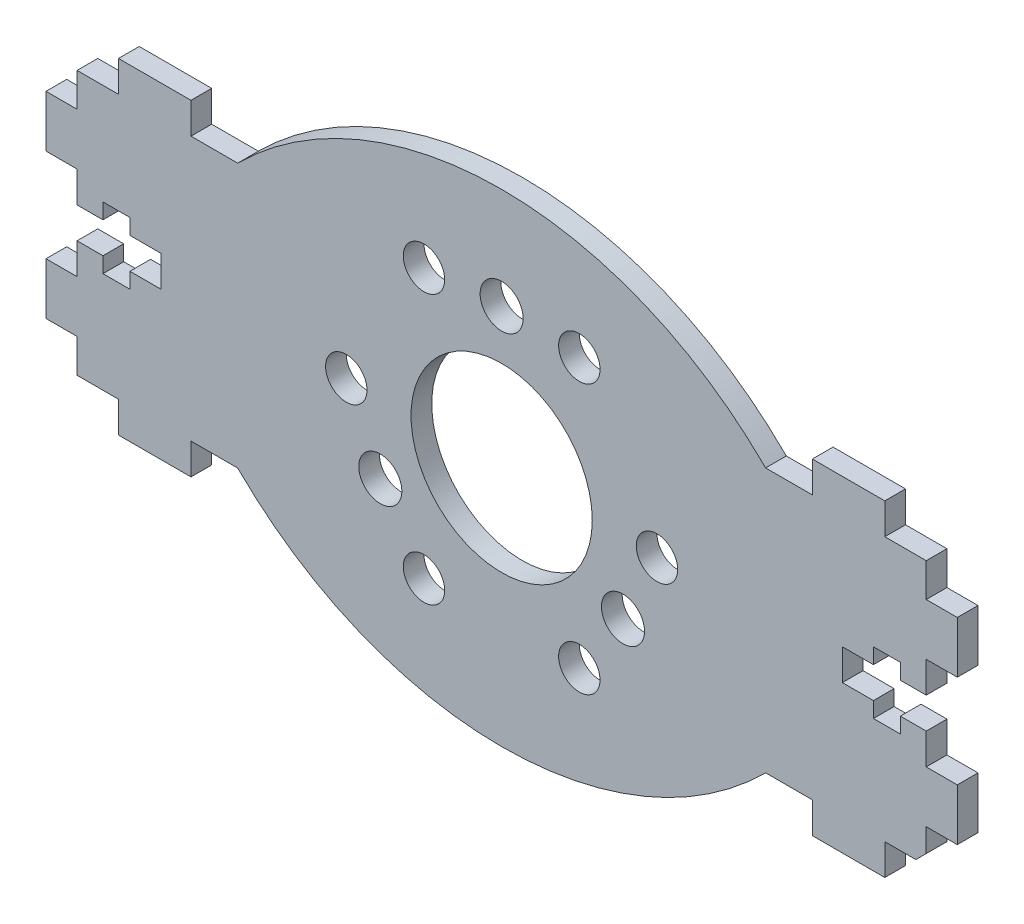
from build123d import *

# Parameters (mm, degrees)
SKETCH_1_R      = 2
SKETCH_1_R_2    = 2.08
SKETCH_1_R_3    = 8.75
EXTRUDE_2_DEPTH = 2


with BuildPart() as part:
    # 草图1 → 凸台-拉伸2 (new body)
    with BuildSketch(Plane.XY):
        with BuildLine():
            Line((-30, 12.75), (-25.488968202, 12.75))
            ThreePointArc((-25.488968202, 12.75), (0, 23.30787632), (25.488968202, 12.75))
            Line((25.488968202, 12.75), (30, 12.75))
            Line((30, 12.75), (30, 15.75))
            Line((30, 15.75), (37, 15.75))
            Line((37, 15.75), (37, 12.75))
            Line((37, 12.75), (41, 12.75))
            Line((41, 12.75), (41, 9.5))
            Line((41, 9.5), (44, 9.5))
            Line((44, 9.5), (44, 4.5))
            Line((44, 4.5), (41, 4.5))
            Line((41, 4.5), (41, 1.5))
            Line((41, 1.5), (38.5, 1.5))
            Line((38.5, 1.5), (38.5, 3))
            Line((38.5, 3), (35.9, 3))
            Line((35.9, 3), (35.9, 1.5))
            Line((35.9, 1.5), (32.9, 1.5))
            Line((32.9, 1.5), (32.9, -1.5))
            Line((32.9, -1.5), (35.9, -1.5))
            Line((35.9, -1.5), (35.9, -3))
            Line((35.9, -3), (38.5, -3))
            Line((38.5, -3), (38.5, -1.5))
            Line((38.5, -1.5), (41, -1.5))
            Line((41, -1.5), (41, -4.5))
            Line((41, -4.5), (44, -4.5))
            Line((44, -4.5), (44, -9.5))
            Line((44, -9.5), (41, -9.5))
            Line((41, -9.5), (41, -11.75))
            Line((41, -11.75), (40, -12.75))
            Line((40, -12.75), (37, -12.75))
            Line((37, -12.75), (37, -15.75))
            Line((37, -15.75), (30, -15.75))
            Line((30, -15.75), (30, -12.75))
            Line((30, -12.75), (25.488968202, -12.75))
            ThreePointArc((25.488968202, -12.75), (0, -23.30787632), (-25.488968202, -12.75))
            Line((-25.488968202, -12.75), (-30, -12.75))
            Line((-30, -12.75), (-30, -15.75))
            Line((-30, -15.75), (-37, -15.75))
            Line((-37, -15.75), (-37, -12.75))
            Line((-37, -12.75), (-41, -12.75))
            Line((-41, -12.75), (-41, -9.5))
            Line((-41, -9.5), (-44, -9.5))
            Line((-44, -9.5), (-44, -4.5))
            Line((-44, -4.5), (-41, -4.5))
            Line((-41, -4.5), (-41, -1.5))
            Line((-41, -1.5), (-38.5, -1.5))
            Line((-38.5, -1.5), (-38.5, -3))
            Line((-38.5, -3), (-35.9, -3))
            Line((-35.9, -3), (-35.9, -1.5))
            Line((-35.9, -1.5), (-32.9, -1.5))
            Line((-32.9, -1.5), (-32.9, 1.5))
            Line((-32.9, 1.5), (-35.9, 1.5))
            Line((-35.9, 1.5), (-35.9, 3))
            Line((-35.9, 3), (-38.5, 3))
            Line((-38.5, 3), (-38.5, 1.5))
            Line((-38.5, 1.5), (-41, 1.5))
            Line((-41, 1.5), (-41, 4.5))
            Line((-41, 4.5), (-44, 4.5))
            Line((-44, 4.5), (-44, 9.5))
            Line((-44, 9.5), (-41, 9.5))
            Line((-41, 9.5), (-41, 12.75))
            Line((-41, 12.75), (-37, 12.75))
            Line((-37, 12.75), (-37, 15.75))
            Line((-37, 15.75), (-30, 15.75))
            Line((-30, 15.75), (-30, 12.75))
        make_face()
        with Locations((-15, 0)):
            Circle(SKETCH_1_R, mode=Mode.SUBTRACT)
        with Locations((-7.5, 12.990381057)):
            Circle(SKETCH_1_R, mode=Mode.SUBTRACT)
        with Locations((7.5, 12.990381057)):
            Circle(SKETCH_1_R, mode=Mode.SUBTRACT)
        with Locations((15, 0)):
            Circle(SKETCH_1_R, mode=Mode.SUBTRACT)
        with Locations((7.5, -12.990381057)):
            Circle(SKETCH_1_R, mode=Mode.SUBTRACT)
        with Locations((-7.5, -12.990381057)):
            Circle(SKETCH_1_R, mode=Mode.SUBTRACT)
        with Locations((0, 13.53)):
            Circle(SKETCH_1_R_2, mode=Mode.SUBTRACT)
        with Locations((11.717323713, -6.765)):
            Circle(SKETCH_1_R_2, mode=Mode.SUBTRACT)
        with Locations((-11.717323713, -6.765)):
            Circle(SKETCH_1_R_2, mode=Mode.SUBTRACT)
        Circle(SKETCH_1_R_3, mode=Mode.SUBTRACT)
    extrude(amount=EXTRUDE_2_DEPTH)


solid = part.part
